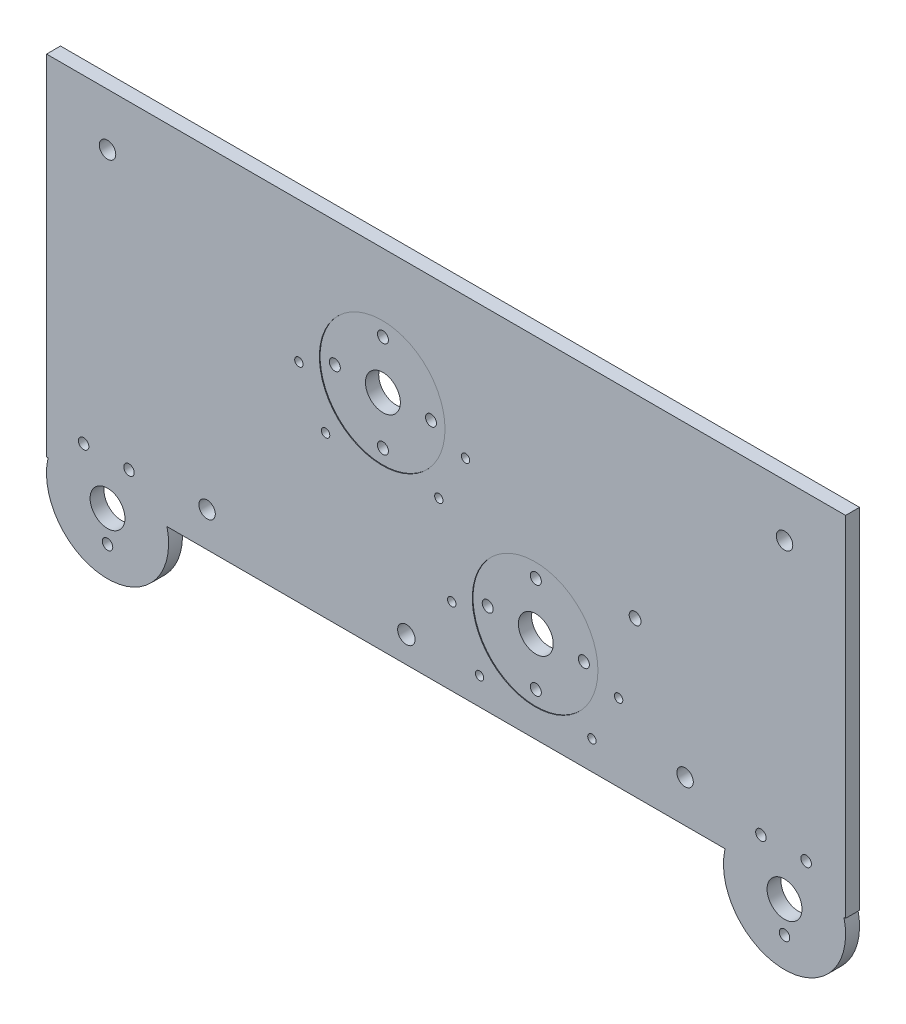
from build123d import *

# Parameters (mm, degrees)
BOSS_EXTRUDE1_DEPTH = 5.07492
SKETCH6_R           = 22.225
BOSS_EXTRUDE3_DEPTH = 5.07492
SKETCH2_3_R         = 6.35
CUT_EXTRUDE2_DEPTH  = 5.588
SKETCH8_W           = 2.728150378
SKETCH8_H           = 127
BOSS_EXTRUDE4_DEPTH = 5.07492
SKETCH9_W           = 1.905
SKETCH9_H           = 127
BOSS_EXTRUDE5_DEPTH = 5.07492
SKETCH12_R          = 3
CUT_EXTRUDE3_DEPTH  = 400.05
CUT_EXTRUDE4_START  = -5.07492
SKETCH13_R          = 22.86
SKETCH13_R_2        = 2
SKETCH13_R_3        = 6.35
CUT_EXTRUDE4_DEPTH  = 0.254
CUT_EXTRUDE6_START  = -127
SKETCH13_2_R        = 2
CUT_EXTRUDE6_DEPTH  = 127
SKETCH17_R          = 2.9972
CUT_EXTRUDE7_DEPTH  = 152.4
CUT_EXTRUDE8_START  = -1549.4
SKETCH13_3_R        = 6.35
CUT_EXTRUDE8_DEPTH  = 1549.4
SKETCH18_R          = 3.175
SKETCH18_R_2        = 2.159
SKETCH18_R_3        = 1.524
CUT_EXTRUDE9_DEPTH  = 6.35
SKETCH19_R          = 1.905
CUT_EXTRUDE10_DEPTH = 6.35


with BuildPart() as part:
    # Sketch2 → Boss-Extrude1 (new body)
    with BuildSketch(Plane.XY):
        with BuildLine():
            Line((-143.383, -31.75), (-127.127, -31.75))
            ThreePointArc((-127.127, -31.75), (-123.317, -30.48), (-119.507, -31.75))
            Line((-119.507, -31.75), (119.253, -31.75))
            ThreePointArc((119.253, -31.75), (123.063, -30.48), (126.873, -31.75))
            Line((126.873, -31.75), (143.383, -31.75))
            Line((143.383, -31.75), (143.383, 95.25))
            Line((143.383, 95.25), (-143.383, 95.25))
            Line((-143.383, 95.25), (-143.383, -31.75))
        make_face()
    extrude(amount=-BOSS_EXTRUDE1_DEPTH)

    # Sketch6 → Boss-Extrude3 (add)
    with BuildSketch(Plane(origin=(0, 0, -5.07492), x_dir=(-1, 0, 0), z_dir=(0, 0, -1))):
        with Locations((-123.063, -36.83)):
            Circle(SKETCH6_R)
        with Locations((123.317, -36.83)):
            Circle(SKETCH6_R)
    extrude(amount=-BOSS_EXTRUDE3_DEPTH)

    # Sketch2<3> → Cut-Extrude2 (cut)
    with BuildSketch(Plane.XY):
        with Locations((-123.317, -36.83)):
            Circle(SKETCH2_3_R)
        with Locations((123.063, -36.83)):
            Circle(SKETCH2_3_R)
    extrude(amount=-CUT_EXTRUDE2_DEPTH, mode=Mode.SUBTRACT)

    # Sketch8 → Boss-Extrude4 (add)
    with BuildSketch(Plane(origin=(0, 0, -5.07492), x_dir=(-1, 0, 0), z_dir=(0, 0, -1))):
        with Locations((144.139824811, 31.75)):
            Rectangle(SKETCH8_W, SKETCH8_H)
    extrude(amount=-BOSS_EXTRUDE4_DEPTH)

    # Sketch9 → Boss-Extrude5 (add)
    with BuildSketch(Plane(origin=(0, 0, -5.07492), x_dir=(-1, 0, 0), z_dir=(0, 0, -1))):
        with Locations((-144.3355, 31.75)):
            Rectangle(SKETCH9_W, SKETCH9_H)
    extrude(amount=-BOSS_EXTRUDE5_DEPTH)

    # Sketch12 → Cut-Extrude3 (cut)
    with BuildSketch(Plane.XY):
        with Locations((-123.317, 76.2)):
            Circle(SKETCH12_R)
        with Locations((123.063, 76.2)):
            Circle(SKETCH12_R)
    extrude(amount=-CUT_EXTRUDE3_DEPTH, mode=Mode.SUBTRACT)

    # Sketch13 → Cut-Extrude4 (cut)
    # profile 1 of 2: a face of its own
    with BuildSketch(Plane(origin=(0, 0, -5.07492), x_dir=(-1, 0, 0), z_dir=(0, 0, -1)).offset(CUT_EXTRUDE4_START)):
        with Locations(Location((23.352511843, 49.53, 0), (0, 0, 180))):
            Circle(SKETCH13_R)
        with Locations(Location((23.352511843, 67.0306, 0), (0, 0, 180))):
            Circle(SKETCH13_R_2, mode=Mode.SUBTRACT)
        with Locations(Location((40.853111843, 49.53, 0), (0, 0, 180))):
            Circle(SKETCH13_R_2, mode=Mode.SUBTRACT)
        with Locations(Location((23.352511843, 32.0294, 0), (0, 0, 180))):
            Circle(SKETCH13_R_2, mode=Mode.SUBTRACT)
        with Locations(Location((5.851911843, 49.53, 0), (0, 0, 180))):
            Circle(SKETCH13_R_2, mode=Mode.SUBTRACT)
        with Locations(Location((23.352511843, 49.53, 0), (0, 0, 180))):
            Circle(SKETCH13_R_3, mode=Mode.SUBTRACT)
    # profile 2 of 2: a face of its own
    with BuildSketch(Plane(origin=(0, 0, -5.07492), x_dir=(-1, 0, 0), z_dir=(0, 0, -1)).offset(CUT_EXTRUDE4_START)):
        with Locations(Location((-32.2961, 1.27, 0), (0, 0, 180))):
            Circle(SKETCH13_R)
        with Locations(Location((-32.2961, 18.7706, 0), (0, 0, 180))):
            Circle(SKETCH13_R_2, mode=Mode.SUBTRACT)
        with Locations(Location((-14.7955, 1.27, 0), (0, 0, 180))):
            Circle(SKETCH13_R_2, mode=Mode.SUBTRACT)
        with Locations(Location((-32.2961, -16.2306, 0), (0, 0, 180))):
            Circle(SKETCH13_R_2, mode=Mode.SUBTRACT)
        with Locations(Location((-49.7967, 1.27, 0), (0, 0, 180))):
            Circle(SKETCH13_R_2, mode=Mode.SUBTRACT)
        with Locations(Location((-32.2961, 1.27, 0), (0, 0, 180))):
            Circle(SKETCH13_R_3, mode=Mode.SUBTRACT)
    extrude(amount=CUT_EXTRUDE4_DEPTH, mode=Mode.SUBTRACT)

    # Sketch13<2> → Cut-Extrude6 (cut)
    with BuildSketch(Plane(origin=(0, 0, -5.07492), x_dir=(-1, 0, 0), z_dir=(0, 0, -1)).offset(CUT_EXTRUDE6_START)):
        with Locations((-32.2961, 18.7706)):
            Circle(SKETCH13_2_R)
        with Locations((-49.7967, 1.27)):
            Circle(SKETCH13_2_R)
        with Locations((-14.7955, 1.27)):
            Circle(SKETCH13_2_R)
        with Locations((-32.2961, -16.2306)):
            Circle(SKETCH13_2_R)
        with Locations((23.352511843, 32.0294)):
            Circle(SKETCH13_2_R)
        with Locations((23.352511843, 67.0306)):
            Circle(SKETCH13_2_R)
        with Locations((40.853111843, 49.53)):
            Circle(SKETCH13_2_R)
        with Locations((5.851911843, 49.53)):
            Circle(SKETCH13_2_R)
    extrude(amount=CUT_EXTRUDE6_DEPTH, mode=Mode.SUBTRACT)

    # Sketch17 → Cut-Extrude7 (cut)
    with BuildSketch(Plane(origin=(0, 0, -5.07492), x_dir=(-1, 0, 0), z_dir=(0, 0, -1))):
        with Locations((87.0839, -19.05)):
            Circle(SKETCH17_R)
        with Locations((-86.868, -16.51)):
            Circle(SKETCH17_R)
    extrude(amount=-CUT_EXTRUDE7_DEPTH, mode=Mode.SUBTRACT)

    # Sketch13<3> → Cut-Extrude8 (cut)
    with BuildSketch(Plane(origin=(0, 0, -5.07492), x_dir=(-1, 0, 0), z_dir=(0, 0, -1)).offset(CUT_EXTRUDE8_START)):
        with Locations((-32.2961, 1.27)):
            Circle(SKETCH13_3_R)
        with Locations((23.352511843, 49.53)):
            Circle(SKETCH13_3_R)
    extrude(amount=CUT_EXTRUDE8_DEPTH, mode=Mode.SUBTRACT)

    # Sketch18 → Cut-Extrude9 (cut)
    with BuildSketch(Plane(origin=(0, 0, -5.07492), x_dir=(-1, 0, 0), z_dir=(0, 0, -1))):
        with Locations((14.5669, -22.225)):
            Circle(SKETCH18_R)
        with Locations((-68.691950102, 24.511)):
            Circle(SKETCH18_R_2)
        with Locations((-62.682085042, -3.620822534)):
            Circle(SKETCH18_R_3)
        with Locations((-1.953743286, -3.620822534)):
            Circle(SKETCH18_R_3)
        with Locations((-12.06825034, -21.868989912)):
            Circle(SKETCH18_R_3)
        with Locations((-52.96225034, -21.321575615)):
            Circle(SKETCH18_R_3)
        with Locations((-6.972782316, 44.115913262)):
            Circle(SKETCH18_R_3)
        with Locations((2.749026104, 26.629515804)):
            Circle(SKETCH18_R_3)
        with Locations((43.955997581, 26.629515804)):
            Circle(SKETCH18_R_3)
        with Locations((53.677806001, 44.115913262)):
            Circle(SKETCH18_R_3)
    extrude(amount=-CUT_EXTRUDE9_DEPTH, mode=Mode.SUBTRACT)

    # Sketch19 → Cut-Extrude10 (cut)
    with BuildSketch(Plane(origin=(0, 0, -5.07492), x_dir=(-1, 0, 0), z_dir=(0, 0, -1))):
        with Locations((-130.937, -20.884382673)):
            Circle(SKETCH19_R)
        with Locations((-114.458147951, -20.884382673)):
            Circle(SKETCH19_R)
        with Locations((-123.063, -48.133)):
            Circle(SKETCH19_R)
        with Locations((115.501615385, -20.779600443)):
            Circle(SKETCH19_R)
        with Locations((132.011615385, -20.779600443)):
            Circle(SKETCH19_R)
        with Locations((123.317, -48.133)):
            Circle(SKETCH19_R)
    extrude(amount=-CUT_EXTRUDE10_DEPTH, mode=Mode.SUBTRACT)


solid = part.part
